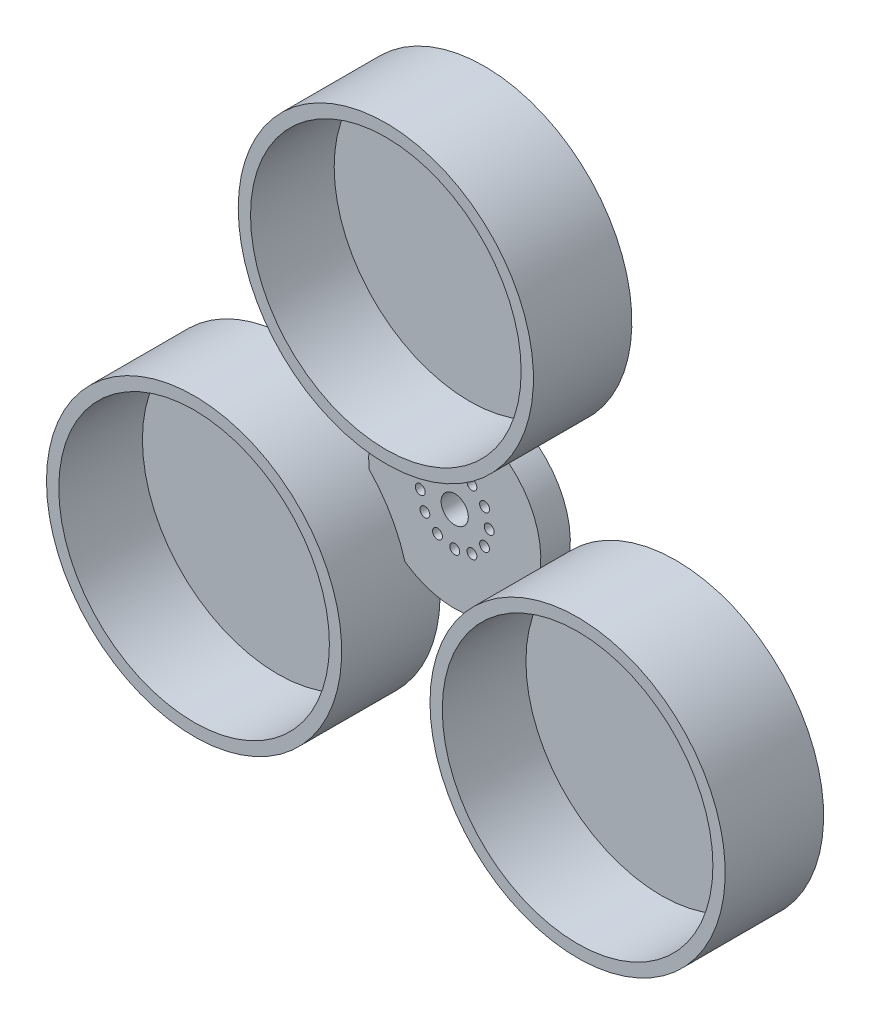
from build123d import *

# Parameters (mm, degrees)
SKETCH_1_R          = 17.5
SKETCH_1_R_2        = 1
SKETCH_1_R_3        = 2.759956758
EXTRUDE_1_DEPTH     = 6
SKETCH_2_R          = 5
CUT_EXTRUDE_1_DEPTH = 2
SKETCH_4_R          = 30
EXTRUDE_2_DEPTH     = 20
SKETCH_5_R          = 27.5
CUT_EXTRUDE_2_DEPTH = 17


with BuildPart() as part:
    # 草图1 → 凸台-拉伸1 (new body)
    with BuildSketch(Plane.XY):
        Circle(SKETCH_1_R)
        with Locations((7, 0)):
            Circle(SKETCH_1_R_2, mode=Mode.SUBTRACT)
        with Locations((6.062177826, -3.5)):
            Circle(SKETCH_1_R_2, mode=Mode.SUBTRACT)
        with Locations((3.5, -6.062177826)):
            Circle(SKETCH_1_R_2, mode=Mode.SUBTRACT)
        with Locations((0, -7)):
            Circle(SKETCH_1_R_2, mode=Mode.SUBTRACT)
        with Locations((-3.5, -6.062177826)):
            Circle(SKETCH_1_R_2, mode=Mode.SUBTRACT)
        with Locations((-6.062177826, -3.5)):
            Circle(SKETCH_1_R_2, mode=Mode.SUBTRACT)
        with Locations((-7, 0)):
            Circle(SKETCH_1_R_2, mode=Mode.SUBTRACT)
        with Locations((-6.062177826, 3.5)):
            Circle(SKETCH_1_R_2, mode=Mode.SUBTRACT)
        with Locations((-3.5, 6.062177826)):
            Circle(SKETCH_1_R_2, mode=Mode.SUBTRACT)
        with Locations((0, 7)):
            Circle(SKETCH_1_R_2, mode=Mode.SUBTRACT)
        with Locations((3.5, 6.062177826)):
            Circle(SKETCH_1_R_2, mode=Mode.SUBTRACT)
        with Locations((6.062177826, 3.5)):
            Circle(SKETCH_1_R_2, mode=Mode.SUBTRACT)
        Circle(SKETCH_1_R_3, mode=Mode.SUBTRACT)
    extrude(amount=EXTRUDE_1_DEPTH)

    # 草图2 → 切除-拉伸1 (cut)
    with BuildSketch(Plane(origin=(0, 0, 0), x_dir=(-1, 0, 0), z_dir=(0, 0, -1))):
        Circle(SKETCH_2_R)
    extrude(amount=-CUT_EXTRUDE_1_DEPTH, mode=Mode.SUBTRACT)

    # 草图4 → 凸台-拉伸2 (add)
    with BuildSketch(Plane(origin=(0, 0, 0), x_dir=(-1, 0, 0), z_dir=(0, 0, -1))):
        with Locations((0, 45)):
            Circle(SKETCH_4_R)
        with Locations((38.97114317, -22.5)):
            Circle(SKETCH_4_R)
        with Locations((-38.97114317, -22.5)):
            Circle(SKETCH_4_R)
    extrude(amount=-EXTRUDE_2_DEPTH)

    # 草图5 → 切除-拉伸2 (cut)
    with BuildSketch(Plane.XY.offset(20)):
        with Locations((0, 45)):
            Circle(SKETCH_5_R)
        with Locations((38.97114317, -22.5)):
            Circle(SKETCH_5_R)
        with Locations((-38.97114317, -22.5)):
            Circle(SKETCH_5_R)
    extrude(amount=-CUT_EXTRUDE_2_DEPTH, mode=Mode.SUBTRACT)


solid = part.part
